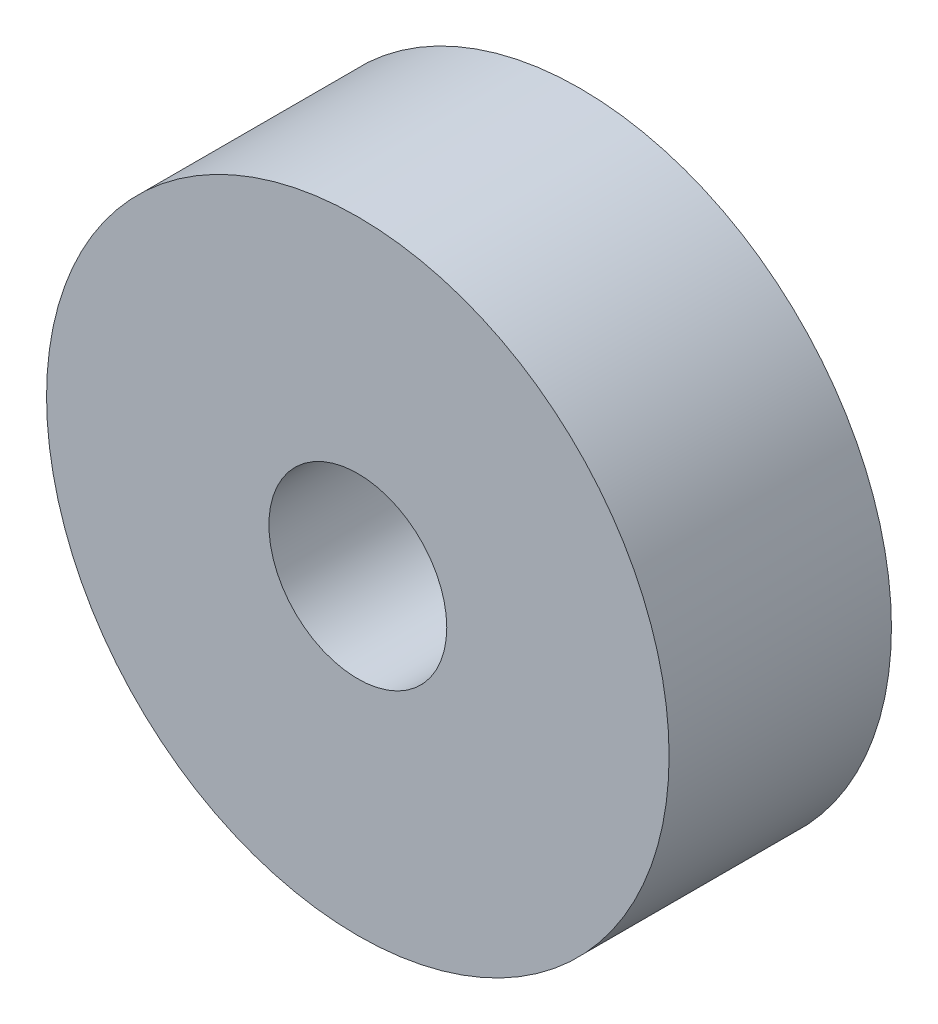
from build123d import *

# Parameters (mm, degrees)
ESQUISSE1_R        = 7
ESQUISSE1_R_2      = 2
BOSS_EXTRU_1_DEPTH = 5


with BuildPart() as part:
    # Esquisse1 → Boss.-Extru.1 (new body)
    with BuildSketch(Plane.XY):
        Circle(ESQUISSE1_R)
        Circle(ESQUISSE1_R_2, mode=Mode.SUBTRACT)
    extrude(amount=BOSS_EXTRU_1_DEPTH)


solid = part.part
